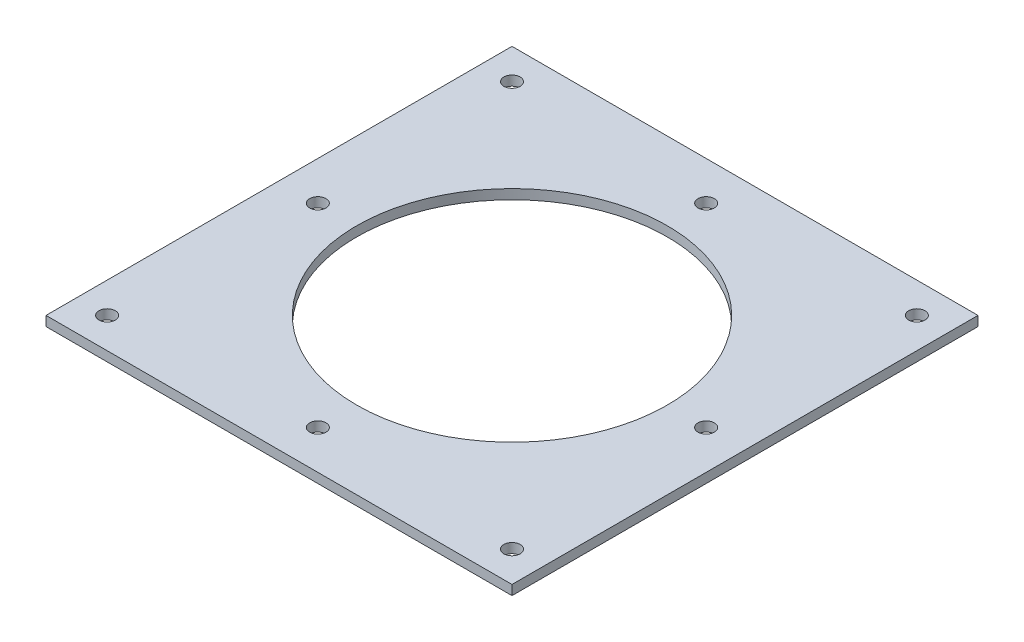
from build123d import *

# Parameters (mm, degrees)
SKETCH2_W           = 152.4
SKETCH2_H           = 152.4
SKETCH2_R           = 50.8
BOSS_EXTRUDE1_DEPTH = 3.175
CUT_EXTRUDE1_REACH  = 109.81
SKETCH3_R           = 2.665000004
CUT_EXTRUDE2_REACH  = 109.81
SKETCH4_R           = 2.665000004


with BuildPart() as part:
    # Sketch2 → Boss-Extrude1 (new body)
    with BuildSketch(Plane(origin=(0, 0, 0), x_dir=(1, 0, 0), z_dir=(0, 1, 0))):
        Rectangle(SKETCH2_W, SKETCH2_H)
        with Locations(Location((0, 0, 0), (0, 0, 270))):
            Circle(SKETCH2_R, mode=Mode.SUBTRACT)
    extrude(amount=BOSS_EXTRUDE1_DEPTH)

    # Sketch3 → Cut-Extrude1 (cut, up to next)
    with BuildSketch(Plane(origin=(0, 3.175, 0), x_dir=(1, 0, 0), z_dir=(0, 1, 0)), mode=Mode.PRIVATE) as cut_extrude1_sk1:
        with Locations(Location((-66.2, -66.2, 0), (0, 0, 270))):
            Circle(SKETCH3_R)
    cut_extrude1_tool1 = extrude(cut_extrude1_sk1.sketch, amount=-CUT_EXTRUDE1_REACH, mode=Mode.PRIVATE) & part.part
    # Sketch3 → Cut-Extrude1 (cut, up to next)
    with BuildSketch(Plane(origin=(0, 3.175, 0), x_dir=(1, 0, 0), z_dir=(0, 1, 0)), mode=Mode.PRIVATE) as cut_extrude1_sk2:
        with Locations(Location((-66.2, 66.2, 0), (0, 0, 90))):
            Circle(SKETCH3_R)
    cut_extrude1_tool2 = extrude(cut_extrude1_sk2.sketch, amount=-CUT_EXTRUDE1_REACH, mode=Mode.PRIVATE) & part.part
    # Sketch3 → Cut-Extrude1 (cut, up to next)
    with BuildSketch(Plane(origin=(0, 3.175, 0), x_dir=(1, 0, 0), z_dir=(0, 1, 0)), mode=Mode.PRIVATE) as cut_extrude1_sk3:
        with Locations(Location((66.2, 66.2, 0), (0, 0, 270))):
            Circle(SKETCH3_R)
    cut_extrude1_tool3 = extrude(cut_extrude1_sk3.sketch, amount=-CUT_EXTRUDE1_REACH, mode=Mode.PRIVATE) & part.part
    # Sketch3 → Cut-Extrude1 (cut, up to next)
    with BuildSketch(Plane(origin=(0, 3.175, 0), x_dir=(1, 0, 0), z_dir=(0, 1, 0)), mode=Mode.PRIVATE) as cut_extrude1_sk4:
        with Locations(Location((66.2, -66.2, 0), (0, 0, 90))):
            Circle(SKETCH3_R)
    cut_extrude1_tool4 = extrude(cut_extrude1_sk4.sketch, amount=-CUT_EXTRUDE1_REACH, mode=Mode.PRIVATE) & part.part
    add(cut_extrude1_tool1.solids().sort_by_distance((-66.2, 3.175, 66.2))[0], mode=Mode.SUBTRACT)
    add(cut_extrude1_tool2.solids().sort_by_distance((-66.2, 3.175, -66.2))[0], mode=Mode.SUBTRACT)
    add(cut_extrude1_tool3.solids().sort_by_distance((66.2, 3.175, -66.2))[0], mode=Mode.SUBTRACT)
    add(cut_extrude1_tool4.solids().sort_by_distance((66.2, 3.175, 66.2))[0], mode=Mode.SUBTRACT)

    # Sketch4 → Cut-Extrude2 (cut, up to next)
    with BuildSketch(Plane(origin=(0, 3.175, 0), x_dir=(1, 0, 0), z_dir=(0, 1, 0)), mode=Mode.PRIVATE) as cut_extrude2_sk1:
        with Locations(Location((0, 63.5, 0), (0, 0, 270))):
            Circle(SKETCH4_R)
    cut_extrude2_tool1 = extrude(cut_extrude2_sk1.sketch, amount=-CUT_EXTRUDE2_REACH, mode=Mode.PRIVATE) & part.part
    # Sketch4 → Cut-Extrude2 (cut, up to next)
    with BuildSketch(Plane(origin=(0, 3.175, 0), x_dir=(1, 0, 0), z_dir=(0, 1, 0)), mode=Mode.PRIVATE) as cut_extrude2_sk2:
        with Locations(Location((-63.5, 0, 0), (0, 0, 270))):
            Circle(SKETCH4_R)
    cut_extrude2_tool2 = extrude(cut_extrude2_sk2.sketch, amount=-CUT_EXTRUDE2_REACH, mode=Mode.PRIVATE) & part.part
    # Sketch4 → Cut-Extrude2 (cut, up to next)
    with BuildSketch(Plane(origin=(0, 3.175, 0), x_dir=(1, 0, 0), z_dir=(0, 1, 0)), mode=Mode.PRIVATE) as cut_extrude2_sk3:
        with Locations(Location((0, -63.5, 0), (0, 0, 270))):
            Circle(SKETCH4_R)
    cut_extrude2_tool3 = extrude(cut_extrude2_sk3.sketch, amount=-CUT_EXTRUDE2_REACH, mode=Mode.PRIVATE) & part.part
    # Sketch4 → Cut-Extrude2 (cut, up to next)
    with BuildSketch(Plane(origin=(0, 3.175, 0), x_dir=(1, 0, 0), z_dir=(0, 1, 0)), mode=Mode.PRIVATE) as cut_extrude2_sk4:
        with Locations(Location((63.5, 0, 0), (0, 0, 270))):
            Circle(SKETCH4_R)
    cut_extrude2_tool4 = extrude(cut_extrude2_sk4.sketch, amount=-CUT_EXTRUDE2_REACH, mode=Mode.PRIVATE) & part.part
    add(cut_extrude2_tool1.solids().sort_by_distance((0, 3.175, -63.5))[0], mode=Mode.SUBTRACT)
    add(cut_extrude2_tool2.solids().sort_by_distance((-63.5, 3.175, 0))[0], mode=Mode.SUBTRACT)
    add(cut_extrude2_tool3.solids().sort_by_distance((0, 3.175, 63.5))[0], mode=Mode.SUBTRACT)
    add(cut_extrude2_tool4.solids().sort_by_distance((63.5, 3.175, 0))[0], mode=Mode.SUBTRACT)


solid = part.part
